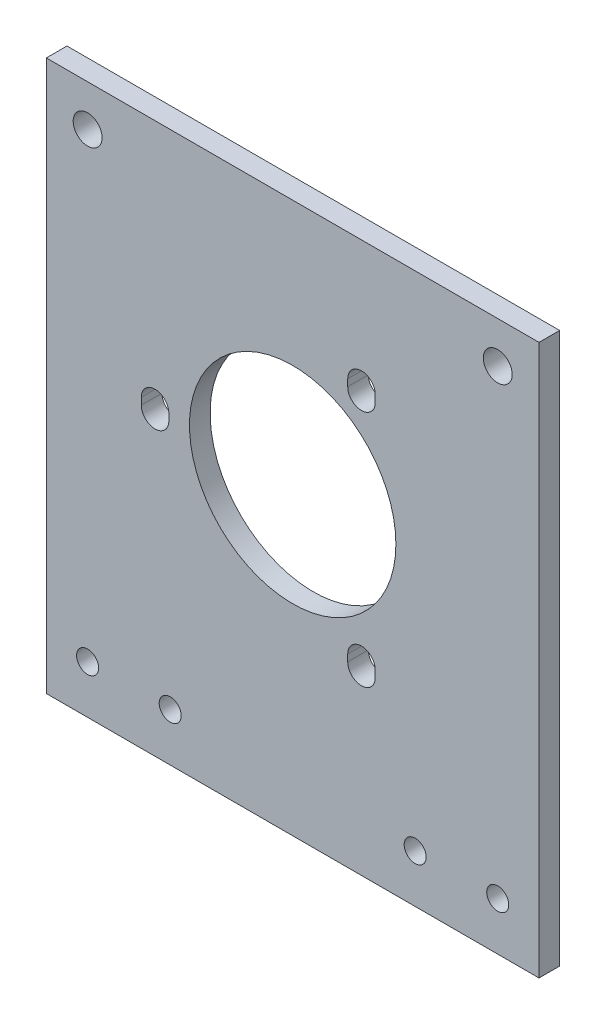
from build123d import *

# Parameters (mm, degrees)
SKETCH_1_W          = 71.6
SKETCH_1_H          = 80
SKETCH_1_R          = 2.1
EXTRUDE_1_DEPTH     = 3
SKETCH_2_R          = 1.6
CUT_EXTRUDE_1_DEPTH = 3
SKETCH_3_R          = 15
CUT_EXTRUDE_2_DEPTH = 3
CUT_EXTRUDE_3_DEPTH = 3


with BuildPart() as part:
    # 草图1 → 凸台-拉伸1 (new body)
    with BuildSketch(Plane.XY):
        with Locations((0, -4.2)):
            Rectangle(SKETCH_1_W, SKETCH_1_H)
        with Locations((-29.8, 29.8)):
            Circle(SKETCH_1_R, mode=Mode.SUBTRACT)
        with Locations((29.8, 29.8)):
            Circle(SKETCH_1_R, mode=Mode.SUBTRACT)
        with BuildLine():
            ThreePointArc((8.833273811, -16.153781887), (8.833273811, -18.487234265), (11.166726189, -18.487234265))
            ThreePointArc((11.166726189, -18.487234265), (11.166726189, -16.153781887), (8.833273811, -16.153781887))
        make_face(mode=Mode.SUBTRACT)
        with BuildLine():
            ThreePointArc((-21.166726189, 1.166726189), (-21.166726189, -1.166726189), (-18.833273811, -1.166726189))
            ThreePointArc((-18.833273811, -1.166726189), (-18.833273811, 1.166726189), (-21.166726189, 1.166726189))
        make_face(mode=Mode.SUBTRACT)
        with BuildLine():
            ThreePointArc((8.833273811, 18.487234265), (8.833273811, 16.153781887), (11.166726189, 16.153781887))
            ThreePointArc((11.166726189, 16.153781887), (11.166726189, 18.487234265), (8.833273811, 18.487234265))
        make_face(mode=Mode.SUBTRACT)
    extrude(amount=EXTRUDE_1_DEPTH)

    # 草图2 → 切除-拉伸1 (cut)
    with BuildSketch(Plane.XY.offset(3)):
        with Locations((29.8, -37.2)):
            Circle(SKETCH_2_R)
        with Locations((17.8, -37.2)):
            Circle(SKETCH_2_R)
        with Locations((-17.8, -37.2)):
            Circle(SKETCH_2_R)
        with Locations((-29.8, -37.2)):
            Circle(SKETCH_2_R)
    extrude(amount=-CUT_EXTRUDE_1_DEPTH, mode=Mode.SUBTRACT)

    # 草图3 → 切除-拉伸2 (cut)
    with BuildSketch(Plane.XY.offset(3)):
        Circle(SKETCH_3_R)
    extrude(amount=-CUT_EXTRUDE_2_DEPTH, mode=Mode.SUBTRACT)

    # 草图4 → 切除-拉伸3 (cut)
    with BuildSketch(Plane.XY.offset(3)):
        with BuildLine():
            Line((12, 17.320508076), (12, 16.320508076))
            ThreePointArc((12, 16.320508076), (10, 14.320508076), (8, 16.320508076))
            Line((8, 16.320508076), (8, 17.320508076))
            ThreePointArc((8, 17.320508076), (10, 19.320508076), (12, 17.320508076))
        make_face()
        with BuildLine():
            Line((-18, 0), (-18, -1))
            ThreePointArc((-18, -1), (-20, -3), (-22, -1))
            Line((-22, -1), (-22, 0))
            ThreePointArc((-22, 0), (-20, 2), (-18, 0))
        make_face()
        with BuildLine():
            Line((12, -17.320508076), (12, -18.320508076))
            ThreePointArc((12, -18.320508076), (10, -20.320508076), (8, -18.320508076))
            Line((8, -18.320508076), (8, -17.320508076))
            ThreePointArc((8, -17.320508076), (10, -15.320508076), (12, -17.320508076))
        make_face()
    extrude(amount=-CUT_EXTRUDE_3_DEPTH, mode=Mode.SUBTRACT)


solid = part.part
